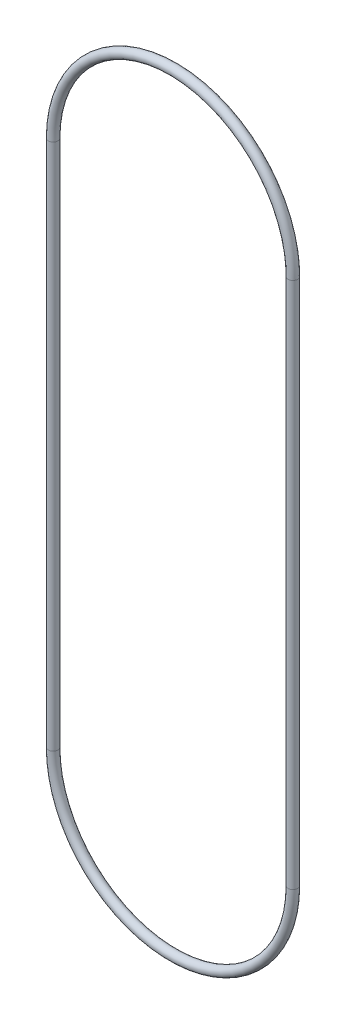
from build123d import *

# Parameters (mm, degrees)
SKETCH3_R = 0.05


with BuildPart() as part:
    # Sweep5: sweep along a path in Sketch1
    with BuildLine(Plane.XY) as sweep5_path:
        Line((1.25, 0), (1.25, -5.5))
        ThreePointArc((1.25, -5.5), (0, -6.75), (-1.25, -5.5))
        Line((-1.25, -5.5), (-1.25, 0))
        ThreePointArc((-1.25, 0), (0, 1.25), (1.25, 0))
    # Sketch3 → Sweep5 (sweep)
    with BuildSketch(Plane(origin=(0, 0, 0), x_dir=(1, 0, 0), z_dir=(0, 1, 0))):
        with Locations((1.25, 0)):
            Circle(SKETCH3_R)
    sweep(path=sweep5_path.line)


solid = part.part
